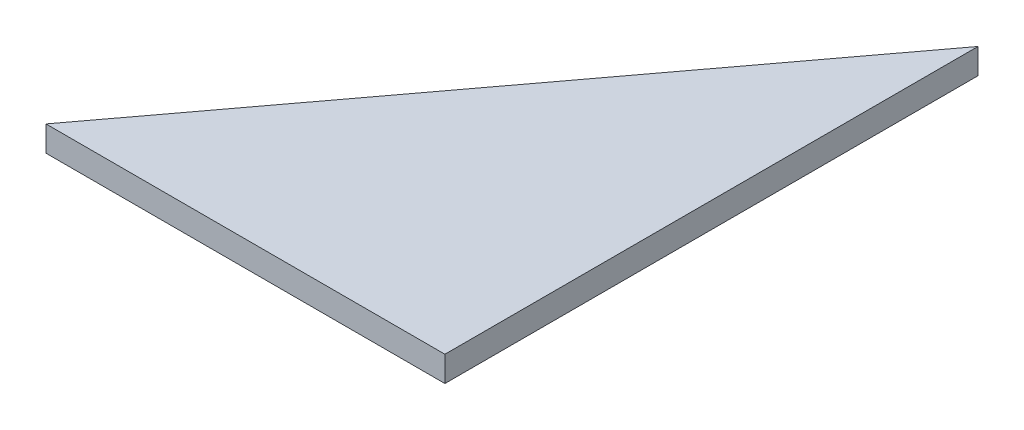
from build123d import *

# Parameters (mm, degrees)
BOSS_EXTRUDE1_DEPTH = 3.5


with BuildPart() as part:
    # Sketch2 → Boss-Extrude1 (new body)
    with BuildSketch(Plane(origin=(0, 0, 0), x_dir=(1, 0, 0), z_dir=(0, 1, 0))):
        Polygon((-39.783440186, -4.848606773), (15.216559814, -4.848606773), (15.216559814, 68.651393227), align=None)
    extrude(amount=BOSS_EXTRUDE1_DEPTH)


solid = part.part
